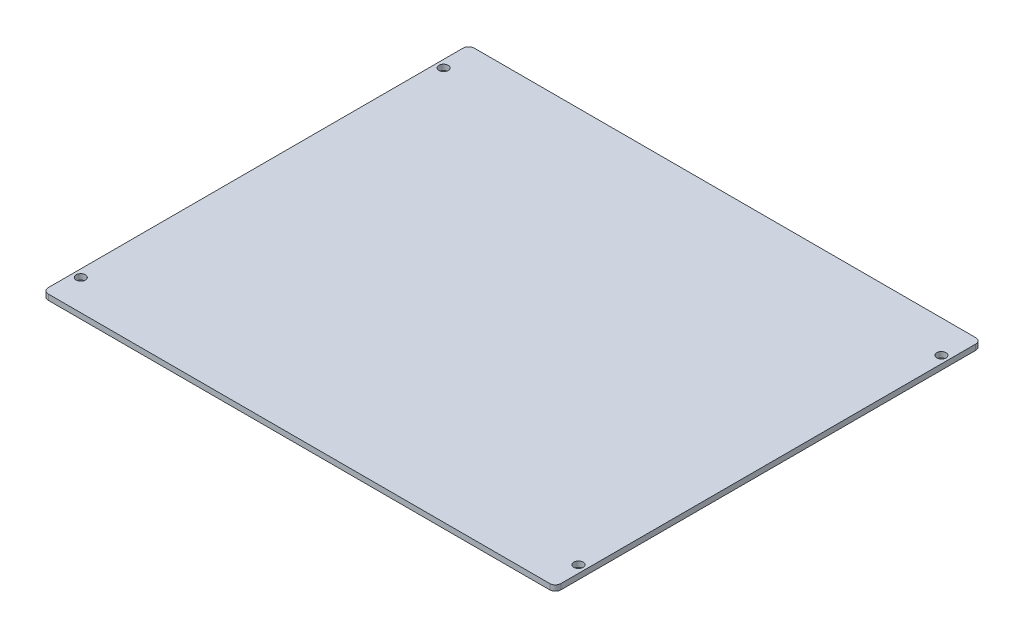
from build123d import *

# Parameters (mm, degrees)
SKETCH1_R           = 2.5
BOSS_EXTRUDE1_DEPTH = 3


with BuildPart() as part:
    # Sketch1 → Boss-Extrude1 (new body)
    with BuildSketch(Plane(origin=(0, 0, 0), x_dir=(1, 0, 0), z_dir=(0, 1, 0))):
        with BuildLine():
            Line((3, 0), (275, 0))
            ThreePointArc((275, 0), (277.121320344, 0.878679656), (278, 3))
            Line((278, 3), (278, 228))
            ThreePointArc((278, 228), (277.121320344, 230.121320344), (275, 231))
            Line((275, 231), (3, 231))
            ThreePointArc((3, 231), (0.878679656, 230.121320344), (0, 228))
            Line((0, 228), (0, 3))
            ThreePointArc((0, 3), (0.878679656, 0.878679656), (3, 0))
        make_face()
        with Locations((4.032261323, 213.395)):
            Circle(SKETCH1_R, mode=Mode.SUBTRACT)
        with Locations((4.032261323, 16.605)):
            Circle(SKETCH1_R, mode=Mode.SUBTRACT)
        with Locations((273.967738677, 16.605)):
            Circle(SKETCH1_R, mode=Mode.SUBTRACT)
        with Locations((273.967738677, 213.395)):
            Circle(SKETCH1_R, mode=Mode.SUBTRACT)
    extrude(amount=BOSS_EXTRUDE1_DEPTH)


solid = part.part
